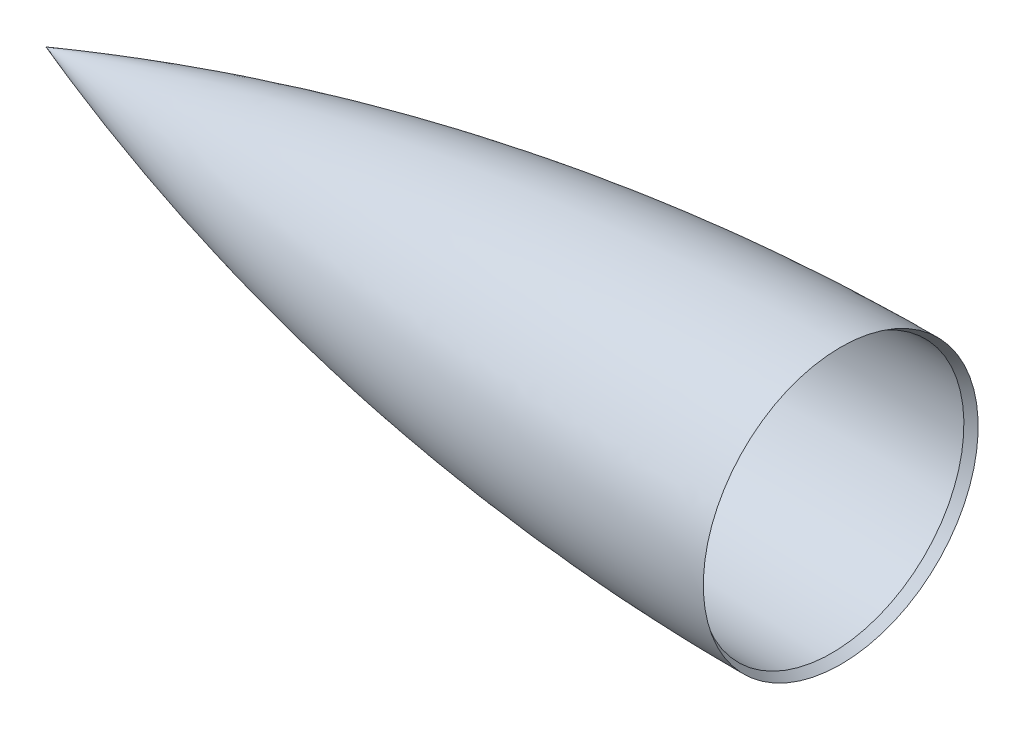
from build123d import *


with BuildPart() as part:
    # Sketch1 → Revolve1 (revolve)
    with BuildSketch(Plane.XY):
        with BuildLine():
            ThreePointArc((0, 39.6), (-116.199354559, 29.627075608), (-229, 0))
            Line((-229, 0), (-219.905427331, 0))
            ThreePointArc((-219.905427331, 0), (-152.025263559, 19.360559463), (-82.501816879, 31.5686821))
            Line((-82.501816879, 31.5686821), (-79.2, 33.474986964))
            ThreePointArc((-79.2, 33.474986964), (-40.968539082, 36.865533836), (-2.606724629, 38.095006834))
            Line((-2.606724629, 38.095006834), (0, 39.6))
        make_face()
    revolve(axis=Axis((0, 0, 0), (-1, 0, 0)))


solid = part.part
